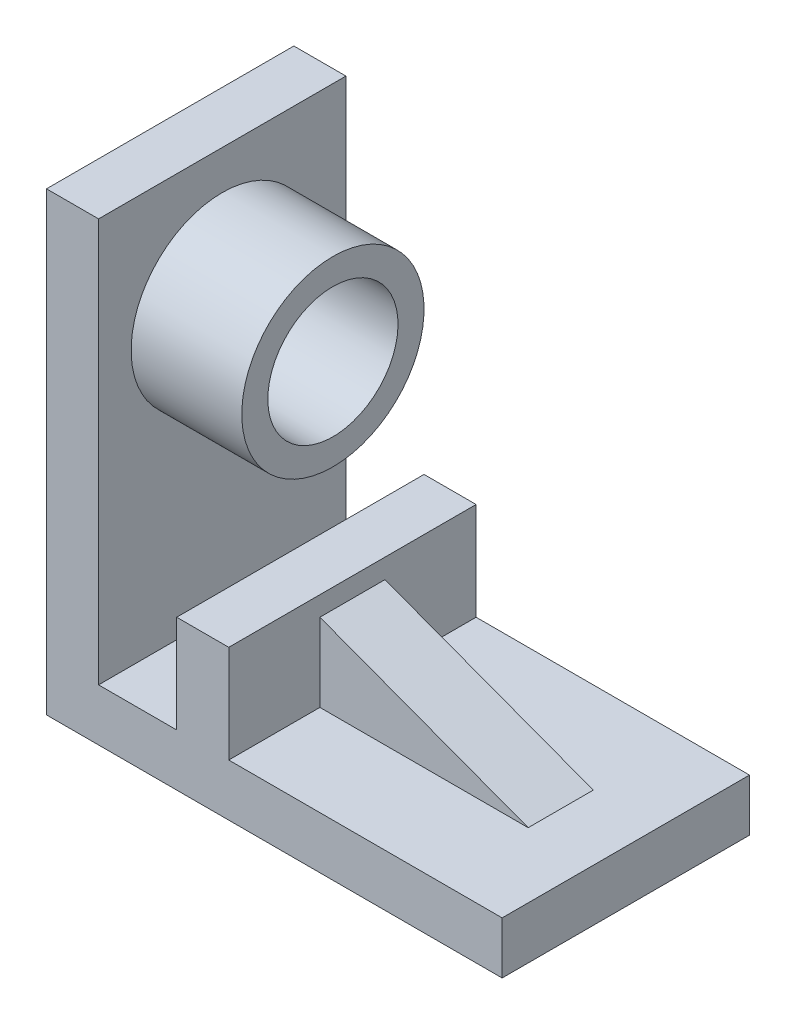
from build123d import *

# Parameters (mm, degrees)
BOSS_EXTRUDE1_DEPTH = 38
RIB1_REACH          = 65.674
SKETCH2_WALL_W      = 163.52442716
SKETCH2_WALL_H      = 10
SKETCH3_R           = 14
SKETCH3_R_2         = 10
BOSS_EXTRUDE2_DEPTH = 17


with BuildPart() as part:
    # Sketch1 → Boss-Extrude1 (new body)
    with BuildSketch(Plane.XY):
        Polygon((-16.097560976, 39.829268293), (-24.097560976, 39.829268293), (-24.097560976, -30.170731707), (45.902439024, -30.170731707), (45.902439024, -22.170731707), (3.902439024, -22.170731707), (3.902439024, -7.170731707), (-4.097560976, -7.170731707), (-4.097560976, -22.170731707), (-16.097560976, -22.170731707), align=None)
    extrude(amount=BOSS_EXTRUDE1_DEPTH)

    # Sketch2 wall → Rib1 (add, up to next)
    with BuildSketch(Plane(origin=(19.902439024, -16.170731707, 19), x_dir=(0.936329177569, -0.351123441588, 0), z_dir=(0.351123441588, 0.936329177569, 0)), mode=Mode.PRIVATE) as rib1_sk1:
        Rectangle(SKETCH2_WALL_W, SKETCH2_WALL_H)
    rib1_tool1 = extrude(rib1_sk1.sketch, amount=-RIB1_REACH, mode=Mode.PRIVATE) - part.part
    add(rib1_tool1.solids().sort_by_distance((19.902439024, -16.170731707, 19))[0])

    # Sketch3 → Boss-Extrude2 (add)
    with BuildSketch(Plane(origin=(-16.097560976, 0, 0), x_dir=(0, 0, -1), z_dir=(1, 0, 0))):
        with Locations(Location((-19, 19.829268293, 0), (0, 0, 270))):
            Circle(SKETCH3_R)
        with Locations(Location((-19, 19.829268293, 0), (0, 0, 90))):
            Circle(SKETCH3_R_2, mode=Mode.SUBTRACT)
    extrude(amount=BOSS_EXTRUDE2_DEPTH)


solid = part.part
